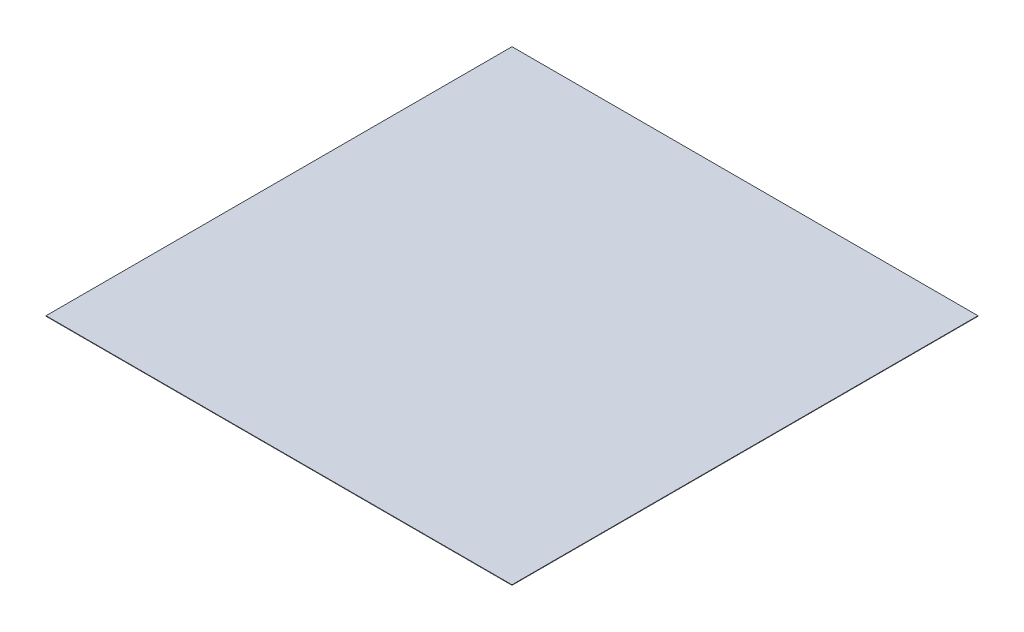
from build123d import *

# Parameters (mm, degrees)
SKETCH1_W           = 10000
SKETCH1_H           = 10000
BOSS_EXTRUDE1_DEPTH = 10


with BuildPart() as part:
    # Sketch1 → Boss-Extrude1 (new body)
    with BuildSketch(Plane(origin=(0, 0, 0), x_dir=(1, 0, 0), z_dir=(0, 1, 0))):
        Rectangle(SKETCH1_W, SKETCH1_H)
    extrude(amount=-BOSS_EXTRUDE1_DEPTH)


solid = part.part
